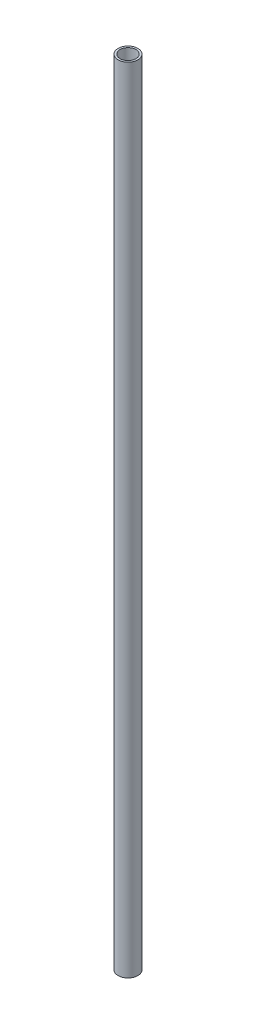
from build123d import *

# Parameters (mm, degrees)
SKETCH1_R           = 12.5
SKETCH1_R_2         = 10
BOSS_EXTRUDE1_DEPTH = 1000


with BuildPart() as part:
    # Sketch1 → Boss-Extrude1 (new body)
    with BuildSketch(Plane(origin=(0, 0, 0), x_dir=(1, 0, 0), z_dir=(0, 1, 0))):
        with Locations(Location((0, 0, 0), (0, 0, 270))):
            Circle(SKETCH1_R)
        with Locations(Location((0, 0, 0), (0, 0, 270))):
            Circle(SKETCH1_R_2, mode=Mode.SUBTRACT)
    extrude(amount=BOSS_EXTRUDE1_DEPTH)


solid = part.part
